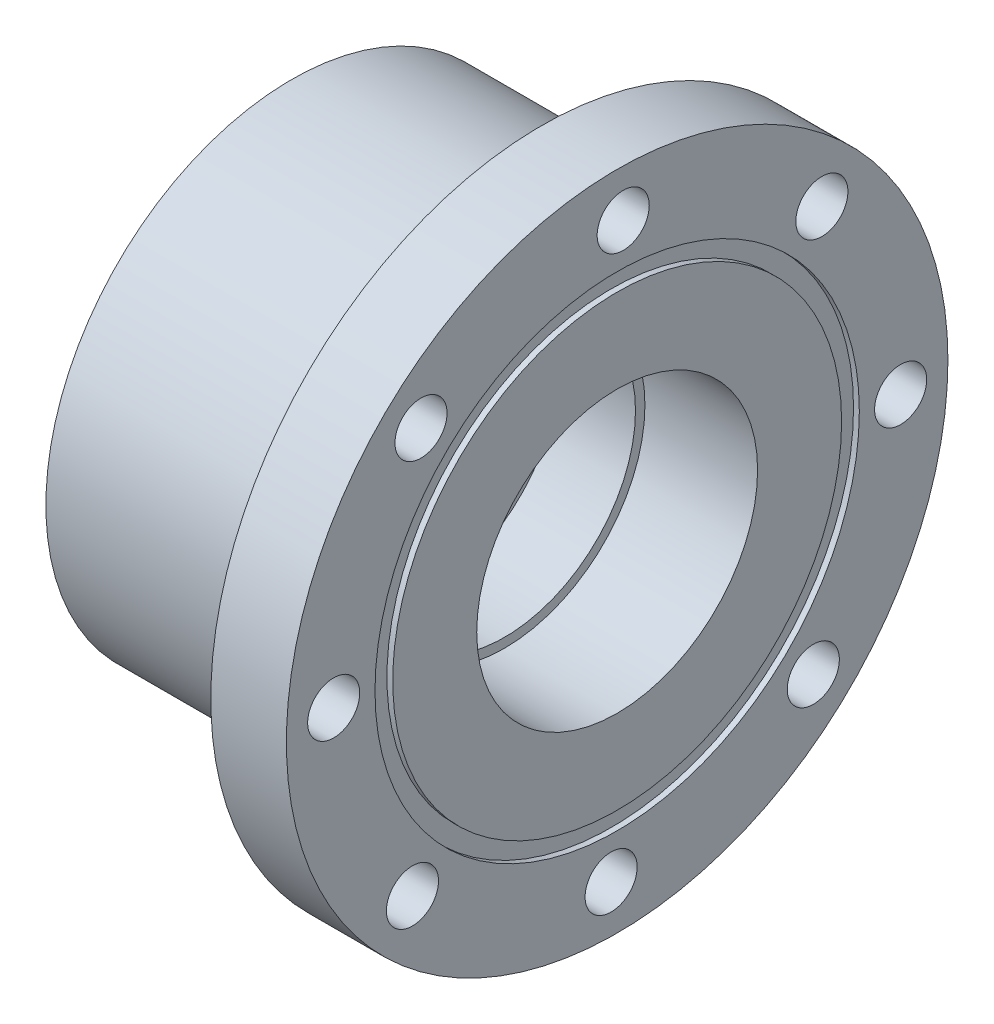
from build123d import *

# Parameters (mm, degrees)
M6_CLEARANCE_HOLE1_D = 7


with BuildPart() as part:
    # Main sketch → Revolve1 (revolve)
    with BuildSketch(Plane.XY, mode=Mode.PRIVATE) as revolve1_sk:
        Polygon((0, 8.500000018), (0, 20.000000005), (-11.999999876, 20.000000005), (-11.999999876, 33.02), (21.59, 33.02), (21.59, 44.45), (31.75, 44.45), (31.75, 32.54375), (30.972125, 32.54375), (30.972125, 30.1625), (31.75, 30.1625), (31.75, 18.8722), (16.6116, 18.8722), (16.6116, 17.6022), (6.35, 17.6022), (6.35, 8.500000018), align=None)
    revolve(revolve1_sk.sketch.rotate(Axis((71.950113838, 0, 0), (-1, 0, 0)), 90), axis=Axis((71.950113838, 0, 0), (-1, 0, 0)))

    # M6 Clearance Hole1 (through all)
    with Locations(Plane(origin=(31.75, 0, 0), x_dir=(0, 0, -1), z_dir=(1, 0, 0))):
        with Locations((0, 0), (-38.091322418, 0.813115257), (-27.509591698, -26.359673074), (-0.813115257, -38.091322418), (26.359673074, -27.509591698), (38.091322418, -0.813115257), (27.509591698, 26.359673074), (0.813115257, 38.091322418), (-26.359673074, 27.509591698)):
            Hole(M6_CLEARANCE_HOLE1_D / 2)


solid = part.part
